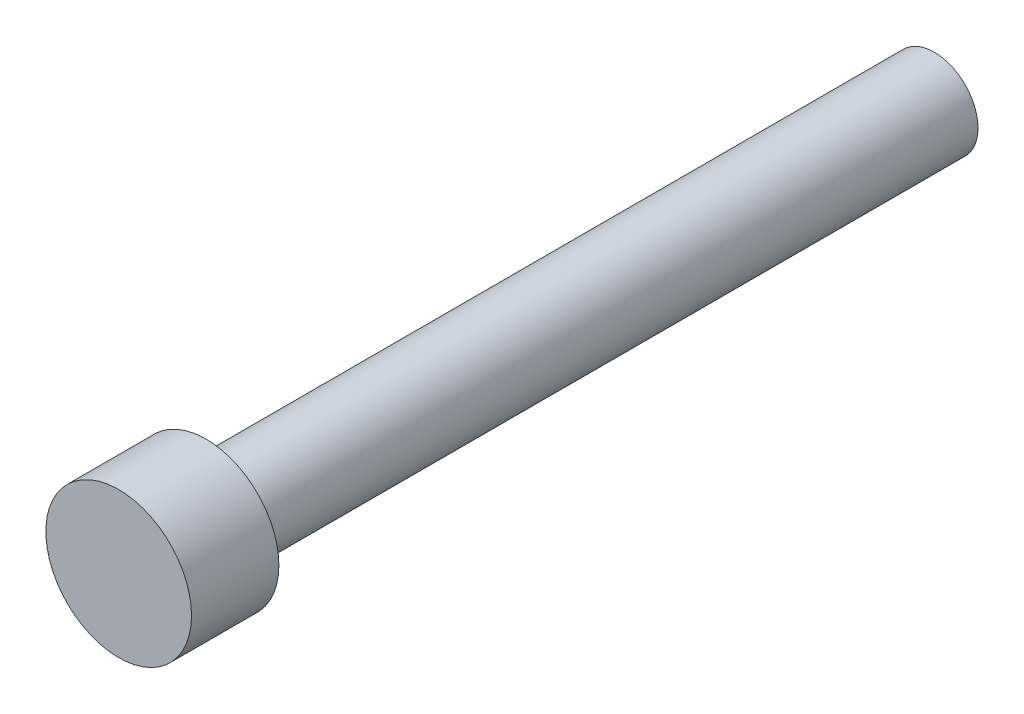
from build123d import *

# Parameters (mm, degrees)
CROQUIS1_R              = 2.5
SALIENTE_EXTRUIR1_DEPTH = 3
CROQUIS1_3_R            = 1.5
SALIENTE_EXTRUIR2_DEPTH = 25


with BuildPart() as part:
    # Croquis1 → Saliente-Extruir1 (new body)
    with BuildSketch(Plane.XY):
        Circle(CROQUIS1_R)
    extrude(amount=SALIENTE_EXTRUIR1_DEPTH)

    # Croquis1<3> → Saliente-Extruir2 (add)
    with BuildSketch(Plane.XY):
        Circle(CROQUIS1_3_R)
    extrude(amount=-SALIENTE_EXTRUIR2_DEPTH)


solid = part.part
